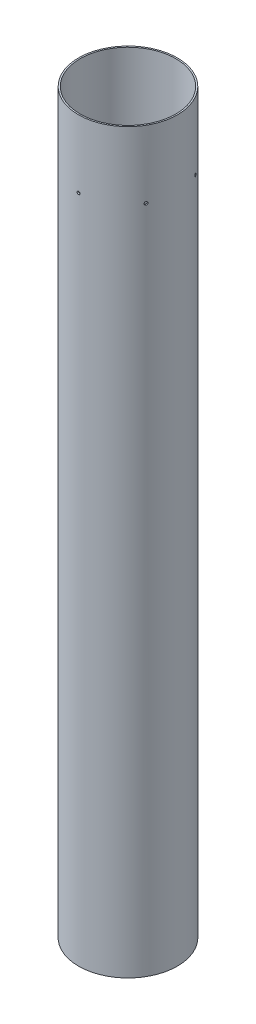
from build123d import *

# Parameters (mm, degrees)
SKETCH1_R           = 51.054
SKETCH1_R_2         = 49.53
BOSS_EXTRUDE1_DEPTH = 762
SKETCH2_R           = 1.524
CUT_EXTRUDE1_DEPTH  = 66.04
CIRPATTERN1_COUNT   = 6


with BuildPart() as part:
    # Sketch1 → Boss-Extrude1 (new body)
    with BuildSketch(Plane(origin=(0, 0, 0), x_dir=(1, 0, 0), z_dir=(0, 1, 0))):
        with Locations(Location((0, 0, 0), (0, 0, 270))):
            Circle(SKETCH1_R)
        with Locations(Location((0, 0, 0), (0, 0, 270))):
            Circle(SKETCH1_R_2, mode=Mode.SUBTRACT)
    extrude(amount=BOSS_EXTRUDE1_DEPTH)

    # Sketch2 → Cut-Extrude1 (cut)
    with BuildSketch(Plane.XY):
        with Locations(Location((0, 692.15, 0), (0, 0, 90))):
            Circle(SKETCH2_R)
    cut_extrude1 = extrude(amount=-CUT_EXTRUDE1_DEPTH, mode=Mode.SUBTRACT)

    # CirPattern1: Cut-Extrude1 ×6 about axis
    cirpattern1_axis = Axis((0, 762, 0), (0, -1, 0))
    for i in range(1, CIRPATTERN1_COUNT):
        add(cut_extrude1.rotate(cirpattern1_axis, i * 360 / CIRPATTERN1_COUNT), mode=Mode.SUBTRACT)


solid = part.part
